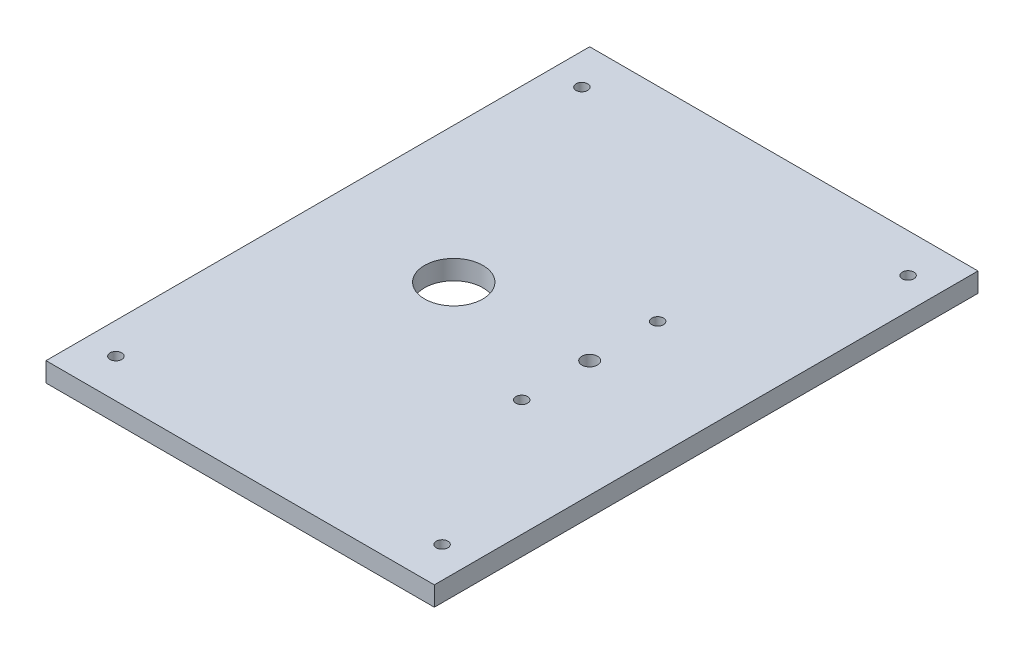
from build123d import *

# Parameters (mm, degrees)
SKETCH1_W                = 100
SKETCH1_H                = 140
SKETCH1_R                = 7.5
SKETCH1_R_2              = 2
SKETCH1_R_3              = 1.5
BOSS_EXTRUDE1_DEPTH      = 5
F_3_0_3_DIAMETER_HOLE1_D = 3


with BuildPart() as part:
    # Sketch1 → Boss-Extrude1 (new body)
    with BuildSketch(Plane(origin=(0, 0, 0), x_dir=(1, 0, 0), z_dir=(0, 1, 0))):
        Rectangle(SKETCH1_W, SKETCH1_H)
        with Locations((-15, 0)):
            Circle(SKETCH1_R, mode=Mode.SUBTRACT)
        with Locations((20, 0)):
            Circle(SKETCH1_R_2, mode=Mode.SUBTRACT)
        with Locations((20, -17.5)):
            Circle(SKETCH1_R_3, mode=Mode.SUBTRACT)
        with Locations((20, 17.5)):
            Circle(SKETCH1_R_3, mode=Mode.SUBTRACT)
    extrude(amount=BOSS_EXTRUDE1_DEPTH)

    # Ø3.0 (3) Diameter Hole1 (through all)
    with Locations(Plane(origin=(0, 5, 0), x_dir=(-1, 0, 0), z_dir=(0, 1, 0))):
        with Locations((-42, 60), (42, 60), (42, -60), (-42, -60)):
            Hole(F_3_0_3_DIAMETER_HOLE1_D / 2)


solid = part.part
